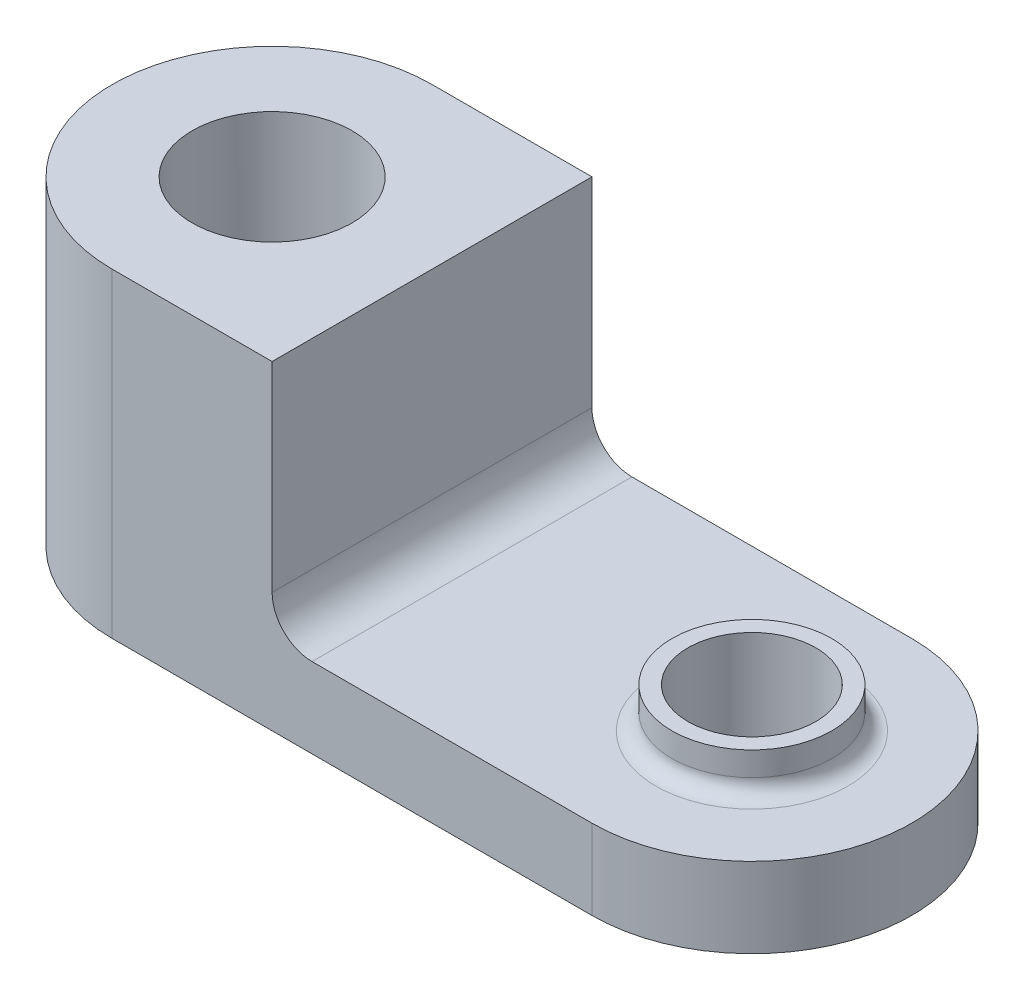
from build123d import *

# Parameters (mm, degrees)
BOSS_EXTRUDE1_DEPTH = 20
FILLET7_RADIUS      = 20
FILLET7_LENGTH      = 40
FILLET8_RADIUS      = 20
FILLET8_LENGTH      = 10
FILLET9_R           = 5
CUT_EXTRUDE1_REACH  = 111.545
SKETCH2_R           = 10
SKETCH2_R_2         = 8
SKETCH2_4_R         = 10
SKETCH2_4_R_2       = 8
BOSS_EXTRUDE2_DEPTH = 15
FILLET10_R          = 2


with BuildPart() as part:
    # Sketch1 → Boss-Extrude1 (new, symmetric)
    with BuildSketch(Plane.XY):
        Polygon((0, 0), (0, 40), (40, 40), (40, 10), (100, 10), (100, 0), align=None)
    extrude(amount=BOSS_EXTRUDE1_DEPTH, both=True)

    # Fillet7: full round fillet: the end face becomes a half cylinder, R = half its width
    fillet7_face = Plane((0, 20, 0), x_dir=(0, 1, 0), z_dir=(-1, 0, 0))  # on the end face: x along it, z out of the body
    fillet7_slab = fillet7_face.offset(-FILLET7_RADIUS / 2) * Box(FILLET7_LENGTH, 2 * FILLET7_RADIUS, FILLET7_RADIUS, mode=Mode.PRIVATE)  # the body's end, R deep
    fillet7_round = Plane((20, 20, 0), x_dir=(-1, 0, 0), z_dir=(0, 1, 0)) * Cylinder(FILLET7_RADIUS, FILLET7_LENGTH, mode=Mode.PRIVATE)  # its axis R under the face
    add(fillet7_slab - fillet7_round, mode=Mode.SUBTRACT)

    # Fillet8: full round fillet: the end face becomes a half cylinder, R = half its width
    fillet8_face = Plane((100, 5, 0), x_dir=(0, 1, 0), z_dir=(1, 0, 0))  # on the end face: x along it, z out of the body
    fillet8_slab = fillet8_face.offset(-FILLET8_RADIUS / 2) * Box(FILLET8_LENGTH, 2 * FILLET8_RADIUS, FILLET8_RADIUS, mode=Mode.PRIVATE)  # the body's end, R deep
    fillet8_round = Plane((80, 5, 0), x_dir=(1, 0, 0), z_dir=(0, 1, 0)) * Cylinder(FILLET8_RADIUS, FILLET8_LENGTH, mode=Mode.PRIVATE)  # its axis R under the face
    add(fillet8_slab - fillet8_round, mode=Mode.SUBTRACT)

    # Fillet9
    fillet9_edges = [part.edges().sort_by_distance(p)[0] for p in [
        (40, 10, 0),
    ]]
    fillet(fillet9_edges, radius=FILLET9_R)

    # Sketch2 → Cut-Extrude1 (cut, up to next)
    with BuildSketch(Plane(origin=(0, 0, 0), x_dir=(1, 0, 0), z_dir=(0, 1, 0)), mode=Mode.PRIVATE) as cut_extrude1_sk1:
        with Locations(Location((20, 0, 0), (0, 0, 90))):
            Circle(SKETCH2_R)
    cut_extrude1_tool1 = extrude(cut_extrude1_sk1.sketch, amount=CUT_EXTRUDE1_REACH, mode=Mode.PRIVATE) & part.part
    # Sketch2 → Cut-Extrude1 (cut, up to next)
    with BuildSketch(Plane(origin=(0, 0, 0), x_dir=(1, 0, 0), z_dir=(0, 1, 0)), mode=Mode.PRIVATE) as cut_extrude1_sk2:
        with Locations(Location((80, 0, 0), (0, 0, 90))):
            Circle(SKETCH2_R_2)
    cut_extrude1_tool2 = extrude(cut_extrude1_sk2.sketch, amount=CUT_EXTRUDE1_REACH, mode=Mode.PRIVATE) & part.part
    add(cut_extrude1_tool1.solids().sort_by_distance((20, 0, 0))[0], mode=Mode.SUBTRACT)
    add(cut_extrude1_tool2.solids().sort_by_distance((80, 0, 0))[0], mode=Mode.SUBTRACT)

    # Sketch2<4> → Boss-Extrude2 (add)
    with BuildSketch(Plane(origin=(0, 0, 0), x_dir=(1, 0, 0), z_dir=(0, 1, 0))):
        with Locations(Location((80, 0, 0), (0, 0, 90))):
            Circle(SKETCH2_4_R)
        with Locations(Location((80, 0, 0), (0, 0, 270))):
            Circle(SKETCH2_4_R_2, mode=Mode.SUBTRACT)
    extrude(amount=BOSS_EXTRUDE2_DEPTH)

    # Fillet10
    fillet10_edges = [part.edges().sort_by_distance(p)[0] for p in [
        (80, 10, 10),
    ]]
    fillet(fillet10_edges, radius=FILLET10_R)


solid = part.part
